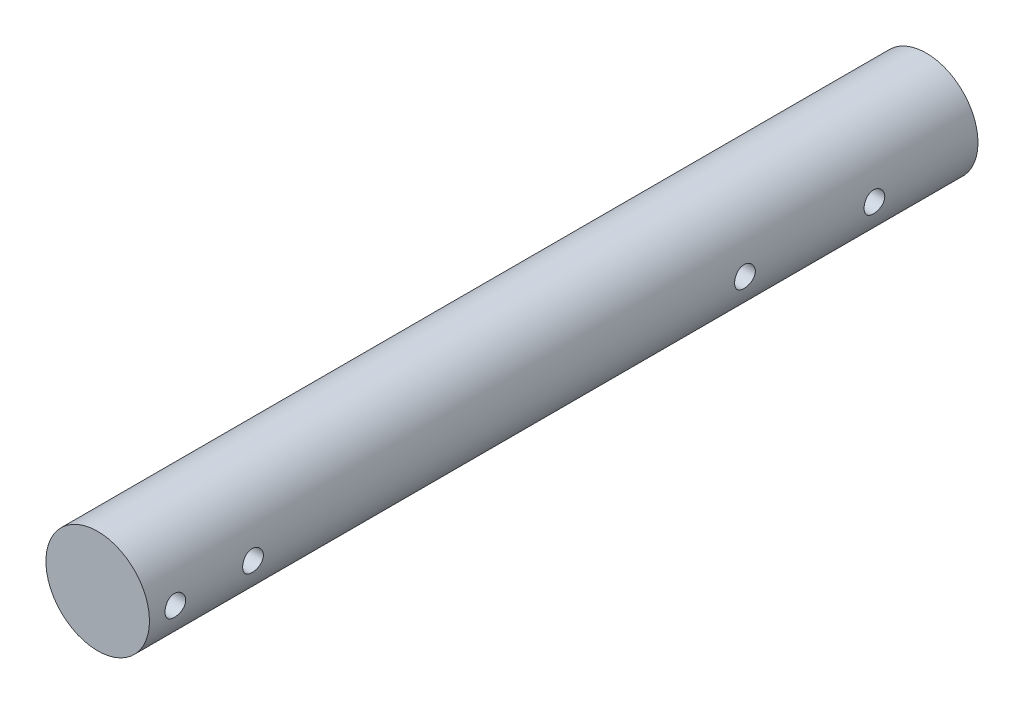
from build123d import *

# Parameters (mm, degrees)
SKETCH1_R               = 20
BOSS_EXTRUDE1_DEPTH     = 320
CUT_EXTRUDE1_DEPTH      = 322.247568084
CUT_EXTRUDE1_DEPTH_BACK = 322.247568084
SKETCH2_R               = 4


with BuildPart() as part:
    # Sketch1 → Boss-Extrude1 (new body)
    with BuildSketch(Plane.XY):
        Circle(SKETCH1_R)
    extrude(amount=BOSS_EXTRUDE1_DEPTH)

    # Sketch2 → Cut-Extrude1 (cut, two sides: drawn at the far end of the back side and taken through both)
    with BuildSketch(Plane(origin=(0, 0, 0), x_dir=(0, 0, -1), z_dir=(1, 0, 0)).offset(-CUT_EXTRUDE1_DEPTH_BACK)):
        with Locations(Location((-40, 0, 0), (0, 0, 180))):
            Circle(SKETCH2_R)
        with Locations((-90, 0)):
            Circle(SKETCH2_R)
        with Locations((-310, 0)):
            Circle(SKETCH2_R)
        with Locations((-280, 0)):
            Circle(SKETCH2_R)
    extrude(amount=CUT_EXTRUDE1_DEPTH + CUT_EXTRUDE1_DEPTH_BACK, mode=Mode.SUBTRACT)


solid = part.part
